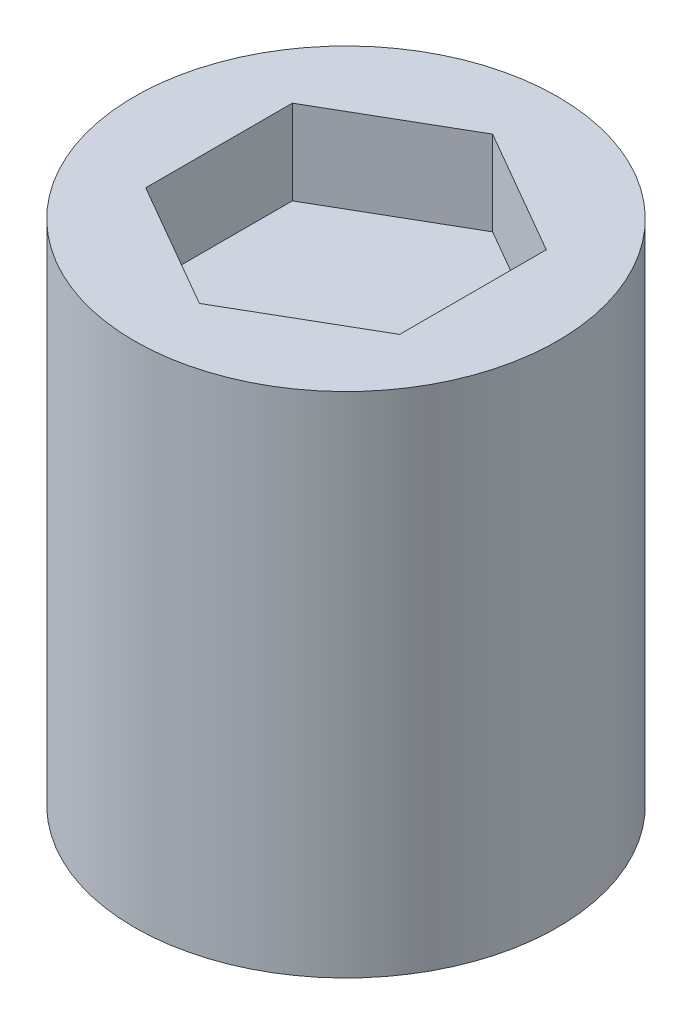
from build123d import *

# Parameters (mm, degrees)
SKETCH2_R           = 12.5
BOSS_EXTRUDE1_DEPTH = 30
SKETCH3_R           = 2.5
CUT_EXTRUDE1_DEPTH  = 10
CUT_EXTRUDE2_DEPTH  = 10
CUT_EXTRUDE3_DEPTH  = 5


with BuildPart() as part:
    # Sketch2 → Boss-Extrude1 (new body)
    with BuildSketch(Plane(origin=(0, 0, 0), x_dir=(1, 0, 0), z_dir=(0, 1, 0))):
        with Locations(Location((0, 0, 0), (0, 0, 270))):
            Circle(SKETCH2_R)
    extrude(amount=BOSS_EXTRUDE1_DEPTH)

    # Sketch3 → Cut-Extrude1 (cut)
    with BuildSketch(Plane(origin=(0, 0, 0), x_dir=(-1, 0, 0), z_dir=(0, -1, 0))):
        with Locations(Location((0, 0, 0), (0, 0, 90))):
            Circle(SKETCH3_R)
    extrude(amount=-CUT_EXTRUDE1_DEPTH, mode=Mode.SUBTRACT)

    # Sketch4 → Cut-Extrude2 (cut)
    with BuildSketch(Plane.XZ.offset(-10)):
        with BuildLine():
            Line((2, 1.5), (2, -1.5))
            ThreePointArc((2, -1.5), (-2.5, 0), (2, 1.5))
        make_face()
    extrude(amount=-CUT_EXTRUDE2_DEPTH, mode=Mode.SUBTRACT)

    # Sketch5 → Cut-Extrude3 (cut)
    with BuildSketch(Plane(origin=(0, 30, 0), x_dir=(1, 0, 0), z_dir=(0, 1, 0))):
        Polygon((0, 8.660254038), (-7.5, 4.330127019), (-7.5, -4.330127019), (0, -8.660254038), (7.5, -4.330127019), (7.5, 4.330127019), align=None)
    extrude(amount=-CUT_EXTRUDE3_DEPTH, mode=Mode.SUBTRACT)


solid = part.part
